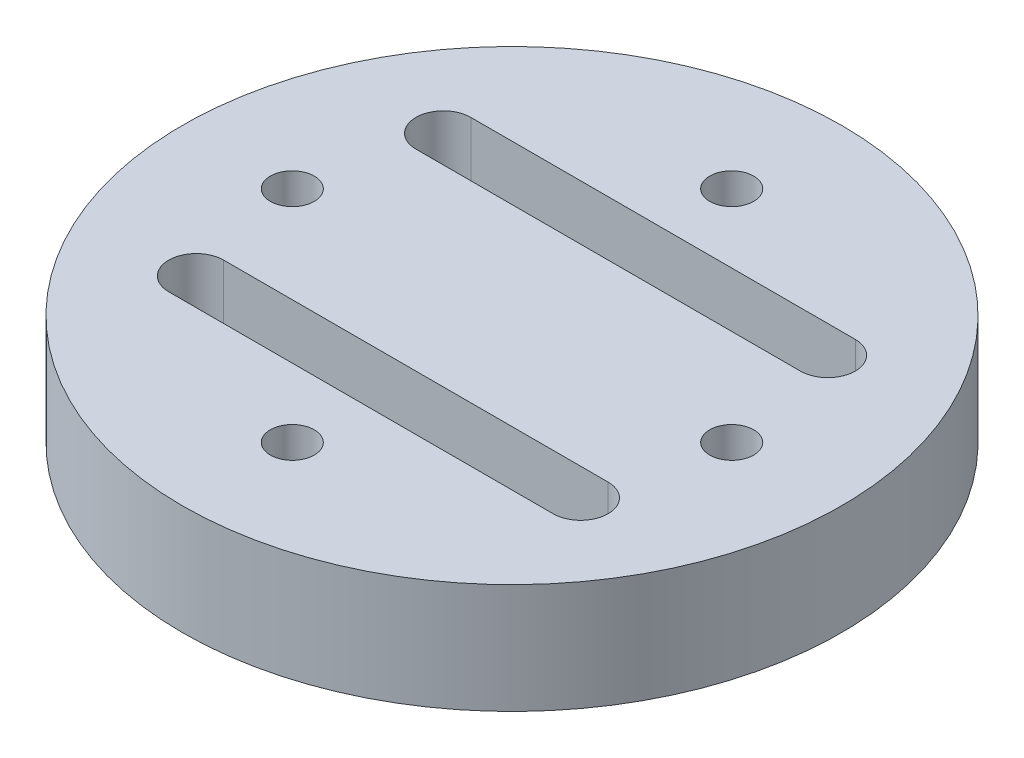
from build123d import *

# Parameters (mm, degrees)
SKETCH2_R               = 60
BOSS_EXTRUDE1_DEPTH     = 20
SKETCH3_W               = 60
SKETCH3_H               = 25
CUT_EXTRUDE1_DEPTH      = 8
CUT_EXTRUDE2_DEPTH      = 40
CUT_EXTRUDE2_DEPTH_BACK = 17
SKETCH4_R               = 6
SKETCH5_R               = 16
CUT_EXTRUDE3_DEPTH      = 16.25
SKETCH6_R               = 4
CUT_EXTRUDE4_DEPTH      = 88.177978871
CUT_EXTRUDE5_DEPTH      = 88.177978871


with BuildPart() as part:
    # Sketch2 → Boss-Extrude1 (new body)
    with BuildSketch(Plane(origin=(0, 0, 0), x_dir=(1, 0, 0), z_dir=(0, 1, 0))):
        with Locations(Location((0, 0, 0), (0, 0, 270))):
            Circle(SKETCH2_R)
    extrude(amount=BOSS_EXTRUDE1_DEPTH)

    # Sketch3 → Cut-Extrude1 (cut)
    with BuildSketch(Plane.XZ):
        Rectangle(SKETCH3_W, SKETCH3_H)
    extrude(amount=-CUT_EXTRUDE1_DEPTH, mode=Mode.SUBTRACT)

    # Sketch4 → Cut-Extrude2 (cut, two sides: drawn at the far end of the back side and taken through both)
    with BuildSketch(Plane.XY.offset(-12.5).offset(-CUT_EXTRUDE2_DEPTH_BACK)):
        with Locations((-17.5, 0)):
            Circle(SKETCH4_R)
        with Locations((17.5, 0)):
            Circle(SKETCH4_R)
    extrude(amount=CUT_EXTRUDE2_DEPTH + CUT_EXTRUDE2_DEPTH_BACK, mode=Mode.SUBTRACT)

    # Sketch5 → Cut-Extrude3 (cut, symmetric)
    with BuildSketch(Plane.XY):
        with Locations((-17.5, 0)):
            Circle(SKETCH5_R)
        with Locations((17.5, 0)):
            Circle(SKETCH5_R)
    extrude(amount=CUT_EXTRUDE3_DEPTH, both=True, mode=Mode.SUBTRACT)

    # Sketch6 → Cut-Extrude4 (cut, through all)
    with BuildSketch(Plane(origin=(0, 20, 0), x_dir=(1, 0, 0), z_dir=(0, 1, 0))):
        with Locations(Location((0, 40, 0), (0, 0, 270))):
            Circle(SKETCH6_R)
        with Locations(Location((40, 0, 0), (0, 0, 270))):
            Circle(SKETCH6_R)
        with Locations(Location((0, -40, 0), (0, 0, 270))):
            Circle(SKETCH6_R)
        with Locations(Location((-40, 0, 0), (0, 0, 270))):
            Circle(SKETCH6_R)
    extrude(amount=-CUT_EXTRUDE4_DEPTH, mode=Mode.SUBTRACT)

    # Sketch7 → Cut-Extrude5 (cut, through all)
    with BuildSketch(Plane(origin=(0, 20, 0), x_dir=(1, 0, 0), z_dir=(0, 1, 0))):
        with BuildLine():
            Line((-35, 27.5), (35, 27.5))
            ThreePointArc((35, 27.5), (40, 22.5), (35, 17.5))
            Line((35, 17.5), (-35, 17.5))
            ThreePointArc((-35, 17.5), (-40, 22.5), (-35, 27.5))
        make_face()
        with BuildLine():
            Line((-35, -27.5), (35, -27.5))
            ThreePointArc((35, -27.5), (40, -22.5), (35, -17.5))
            Line((35, -17.5), (-35, -17.5))
            ThreePointArc((-35, -17.5), (-40, -22.5), (-35, -27.5))
        make_face()
    extrude(amount=-CUT_EXTRUDE5_DEPTH, mode=Mode.SUBTRACT)


solid = part.part
